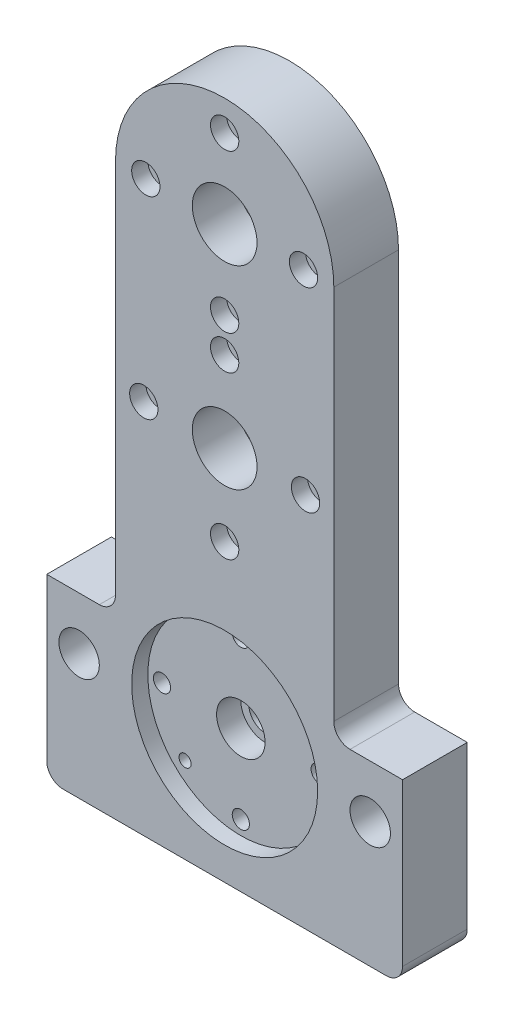
from build123d import *

# Parameters (mm, degrees)
BOLT_CIRCLE_R                                     = 12.7
BOLT_CIRCLE_R_2                                   = 6.35
BASE_DEPTH                                        = 12.7
STRUCTURE_TUBE_CONNECTION_COUNTERBORE_D           = 6.7564
STRUCTURE_TUBE_CONNECTION_COUNTERBORE_CBORE_D     = 11.1125
STRUCTURE_TUBE_CONNECTION_COUNTERBORE_CBORE_DEPTH = 6.35
STRUCTURE_TUBE_CONNECTION_COUNTERBORE_PA_COUNT    = 4
SPINDLE_CONNECTION_COUNTERBORE_D                  = 6.7564
SPINDLE_CONNECTION_COUNTERBORE_CBORE_D            = 11.1125
SPINDLE_CONNECTION_COUNTERBORE_CBORE_DEPTH        = 6.35
SPINDLE_CONNECTION_COUNTERBORE_PATTERN_COUNT      = 4
SKETCH16_R                                        = 36.5125
STRUCTURE_TUBE_MOUNTING_POCKET_DEPTH              = 6.35
SKETCH17_R                                        = 36.5125
SPINDLE_MOUNTING_POCKET_DEPTH                     = 7.62
SKETCH18_R                                        = 9.525
LEAD_SCREW_THROUGH_HOLE_DEPTH                     = 9.525
SKETCH20_R                                        = 7.9375
RAIL_MOUNTING_PILOT_HOLES_DEPTH                   = 166.290695159
SKETCH27_R                                        = 2.38125
ALIGNMENT_FEATURES_DEPTH                          = 6.35
GENERIC_ROUNDING_FILLET_R                         = 6.35
WOOD_SPINDLE_CBORE_D                              = 6.7564
WOOD_SPINDLE_CBORE_CBORE_D                        = 11.1125
WOOD_SPINDLE_CBORE_CBORE_DEPTH                    = 6.35
CIRPATTERN1_COUNT                                 = 4
SKETCH30_R                                        = 36.5125
CUT_EXTRUDE1_DEPTH                                = 7.62


with BuildPart() as part:
    # Bolt circle → Base (new, symmetric)
    with BuildSketch(Plane.XY):
        with BuildLine():
            Line((-42.8625, 76.2), (-42.8625, -77.7875))
            Line((-42.8625, -77.7875), (-69.85, -77.7875))
            Line((-69.85, -77.7875), (-69.85, -147.6375))
            Line((-69.85, -147.6375), (69.85, -147.6375))
            Line((69.85, -147.6375), (69.85, -77.7875))
            Line((69.85, -77.7875), (42.8625, -77.7875))
            Line((42.8625, -77.7875), (42.8625, 76.2))
            ThreePointArc((42.8625, 76.2), (0, 119.0625), (-42.8625, 76.2))
        make_face()
        with Locations((0, 76.2)):
            Circle(BOLT_CIRCLE_R, mode=Mode.SUBTRACT)
        Circle(BOLT_CIRCLE_R, mode=Mode.SUBTRACT)
        with Locations((0, -98.425)):
            Circle(BOLT_CIRCLE_R_2, mode=Mode.SUBTRACT)
    extrude(amount=BASE_DEPTH, both=True)

    # Structure tube connection counterbore (through all)
    with Locations(Plane(origin=(0, 0, -12.7), x_dir=(-1, 0, 0), z_dir=(0, 0, -1))):
        with Locations((0, -67.46875)):
            structure_tube_connection_counterbore = CounterBoreHole(STRUCTURE_TUBE_CONNECTION_COUNTERBORE_D / 2, STRUCTURE_TUBE_CONNECTION_COUNTERBORE_CBORE_D / 2, STRUCTURE_TUBE_CONNECTION_COUNTERBORE_CBORE_DEPTH)

    # Structure tube connection counterbore pattern: Structure tube connection counterbore ×4 about axis
    structure_tube_connection_counterbore_pa_axis = Axis((0, -98.425, 12.7), (0, 0, -1))
    for i in range(1, STRUCTURE_TUBE_CONNECTION_COUNTERBORE_PA_COUNT):
        add(structure_tube_connection_counterbore.rotate(structure_tube_connection_counterbore_pa_axis, i * 360 / STRUCTURE_TUBE_CONNECTION_COUNTERBORE_PA_COUNT), mode=Mode.SUBTRACT)

    # Spindle connection counterbore (through all)
    with Locations(Plane.XY.offset(12.7)):
        with Locations((0, 31.75)):
            spindle_connection_counterbore = CounterBoreHole(SPINDLE_CONNECTION_COUNTERBORE_D / 2, SPINDLE_CONNECTION_COUNTERBORE_CBORE_D / 2, SPINDLE_CONNECTION_COUNTERBORE_CBORE_DEPTH)

    # Spindle connection counterbore pattern: Spindle connection counterbore ×4 about axis
    spindle_connection_counterbore_pattern_axis = Axis((0, 0, 12.7), (0, 0, -1))
    for i in range(1, SPINDLE_CONNECTION_COUNTERBORE_PATTERN_COUNT):
        add(spindle_connection_counterbore.rotate(spindle_connection_counterbore_pattern_axis, i * 360 / SPINDLE_CONNECTION_COUNTERBORE_PATTERN_COUNT), mode=Mode.SUBTRACT)

    # Sketch16 → Structure tube mounting pocket (cut)
    with BuildSketch(Plane.XY.offset(12.7)):
        with Locations((0, -98.425)):
            Circle(SKETCH16_R)
    extrude(amount=-STRUCTURE_TUBE_MOUNTING_POCKET_DEPTH, mode=Mode.SUBTRACT)

    # Sketch17 → Spindle mounting pocket (cut)
    with BuildSketch(Plane(origin=(0, 0, -12.7), x_dir=(-1, 0, 0), z_dir=(0, 0, -1))):
        Circle(SKETCH17_R)
    extrude(amount=-SPINDLE_MOUNTING_POCKET_DEPTH, mode=Mode.SUBTRACT)

    # Sketch18 → Lead screw through hole (cut)
    with BuildSketch(Plane.XY.offset(6.35)):
        with Locations((0, -98.425)):
            Circle(SKETCH18_R)
    extrude(amount=-LEAD_SCREW_THROUGH_HOLE_DEPTH, mode=Mode.SUBTRACT)

    # Sketch20 → Rail mounting pilot_holes (cut, through all)
    with BuildSketch(Plane.XY.offset(12.7)):
        with Locations((57.15, -98.425)):
            Circle(SKETCH20_R)
        with Locations((-57.15, -98.425)):
            Circle(SKETCH20_R)
    extrude(amount=-RAIL_MOUNTING_PILOT_HOLES_DEPTH, mode=Mode.SUBTRACT)

    # Sketch27 → Alignment_features (cut)
    with BuildSketch(Plane.XY.offset(6.35)):
        with Locations((-21.889374295, -120.314374295)):
            Circle(SKETCH27_R)
        with BuildLine():
            Line((20.681324246, -74.335397148), (19.602797121, -75.500272889))
            ThreePointArc((19.602797121, -75.500272889), (19.732320046, -78.865377187), (23.097424344, -78.735854262))
            Line((23.097424344, -78.735854262), (24.175951469, -77.570978521))
            ThreePointArc((24.175951469, -77.570978521), (24.046428544, -74.205874223), (20.681324246, -74.335397148))
        make_face()
    extrude(amount=-ALIGNMENT_FEATURES_DEPTH, mode=Mode.SUBTRACT)

    # Generic_rounding_fillet
    generic_rounding_fillet_edges = [part.edges().sort_by_distance(p)[0] for p in [
        (42.8625, -77.7875, 0),
        (-42.8625, -77.7875, 0),
        (-69.85, -147.6375, 0),
        (69.85, -147.6375, 0),
    ]]
    fillet(generic_rounding_fillet_edges, radius=GENERIC_ROUNDING_FILLET_R)

    # wood_spindle_CBORE (through all)
    with Locations(Plane.XY.offset(12.7)):
        with Locations((0, 107.15625)):
            wood_spindle_cbore = CounterBoreHole(WOOD_SPINDLE_CBORE_D / 2, WOOD_SPINDLE_CBORE_CBORE_D / 2, WOOD_SPINDLE_CBORE_CBORE_DEPTH)

    # CirPattern1: wood_spindle_CBORE ×4 about axis
    cirpattern1_axis = Axis((0, 76.2, 12.7), (0, 0, -1))
    for i in range(1, CIRPATTERN1_COUNT):
        add(wood_spindle_cbore.rotate(cirpattern1_axis, i * 360 / CIRPATTERN1_COUNT), mode=Mode.SUBTRACT)

    # Sketch30 → Cut-Extrude1 (cut)
    with BuildSketch(Plane(origin=(0, 0, -12.7), x_dir=(-1, 0, 0), z_dir=(0, 0, -1))):
        with Locations((0, 76.2)):
            Circle(SKETCH30_R)
    extrude(amount=-CUT_EXTRUDE1_DEPTH, mode=Mode.SUBTRACT)


solid = part.part
